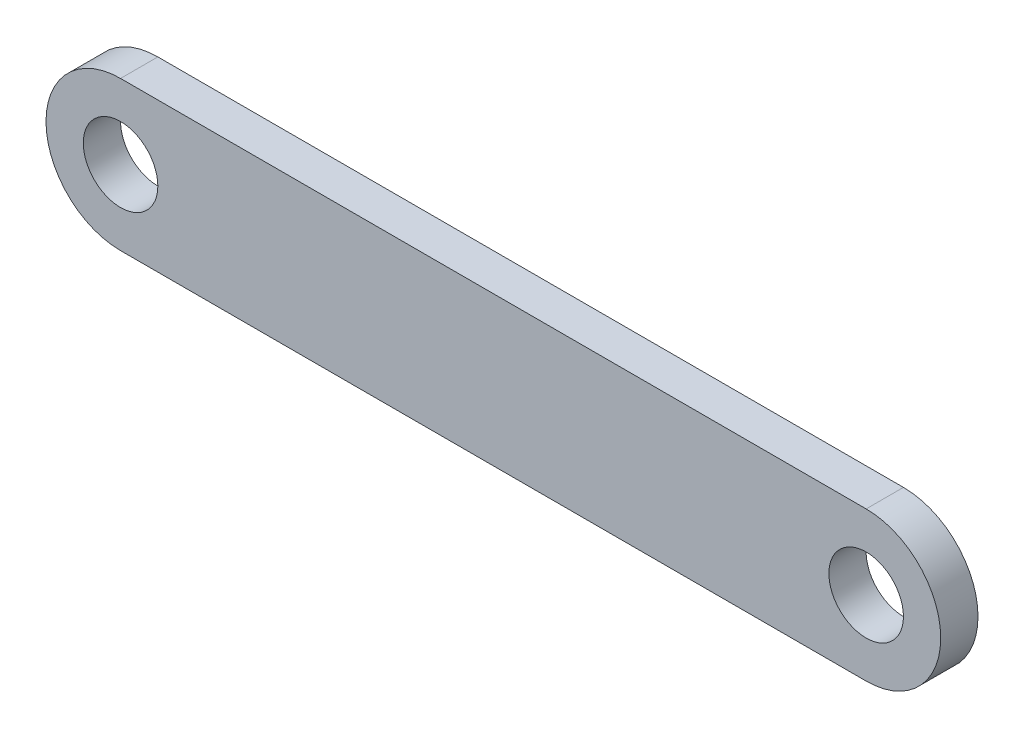
from build123d import *

# Parameters (mm, degrees)
BOSS_EXTRUDE1_DEPTH      = 2.5
BOSS_EXTRUDE1_DEPTH_BACK = 2.5
SKETCH1_R                = 5


with BuildPart() as part:
    # Sketch1 → Boss-Extrude1 (new, two sides: drawn at the far end of the back side and taken through both)
    with BuildSketch(Plane.XY.offset(-BOSS_EXTRUDE1_DEPTH_BACK)):
        with BuildLine():
            Line((0, -10), (100, -10))
            ThreePointArc((100, -10), (110, 0), (100, 10))
            Line((100, 10), (0, 10))
            ThreePointArc((0, 10), (-10, 0), (0, -10))
        make_face()
        Circle(SKETCH1_R, mode=Mode.SUBTRACT)
        with Locations((100, 0)):
            Circle(SKETCH1_R, mode=Mode.SUBTRACT)
    extrude(amount=BOSS_EXTRUDE1_DEPTH + BOSS_EXTRUDE1_DEPTH_BACK)


solid = part.part
